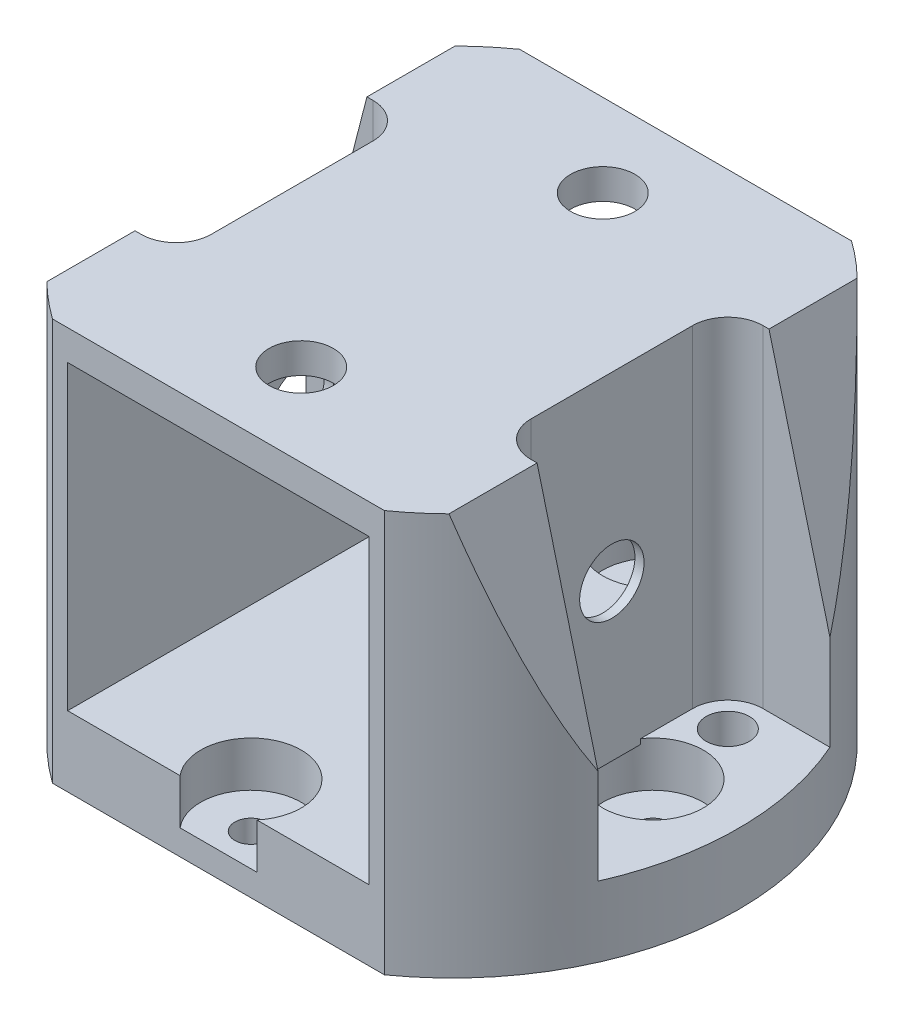
from build123d import *

# Parameters (mm, degrees)
SKETCH1_W                       = 30
SKETCH1_H                       = 30
BOSS_EXTRUDE1_DEPTH             = 28.5
CUT_EXTRUDE1_DEPTH              = 53.091266063
CUT_EXTRUDE1_DEPTH_BACK         = 53.091266063
SKETCH3_R                       = 2.15
SKETCH3_R_2                     = 1.6
CUT_EXTRUDE2_DEPTH              = 53.091266063
CUT_EXTRUDE3_DEPTH              = 53.091266063
CUT_EXTRUDE3_DEPTH_BACK         = 53.091266063
SKETCH5_OUTSIDE_W               = 76.998
SKETCH5_OUTSIDE_H               = 76.998
SKETCH5_OUTSIDE_R               = 28.5
CUT_EXTRUDE4_DEPTH              = 53.091266063
CUT_EXTRUDE4_DEPTH_BACK         = 53.091266063
SKETCH7_R                       = 5
CUT_EXTRUDE5_DEPTH              = 4.5
SKETCH3_3_R                     = 1.6
CUT_EXTRUDE6_DEPTH              = 50.406816501
SKETCH8_R                       = 5
CUT_EXTRUDE7_DEPTH              = 4.5
SKETCH9_W                       = 0.901470183
SKETCH9_H                       = 10
BOSS_EXTRUDE2_DEPTH             = 33.5
CUT_EXTRUDE9_DEPTH              = 50.406816501
CUT_EXTRUDE9_DEPTH_BACK         = 50.406816501
SKETCH10_R                      = 3.2
CUT_EXTRUDE10_REACH             = 56.333
SKETCH11_R                      = 3.2
CUT_EXTRUDE10_DIRECTION_2_DEPTH = 55.33261927


with BuildPart() as part:
    # Sketch1 → Boss-Extrude1 (new, symmetric)
    with BuildSketch(Plane.XY):
        Polygon((-28.5, 0), (-20, 33), (20, 33), (28.5, 0), (28.5, -7), (-28.5, -7), align=None)
        with Locations((0, 15)):
            Rectangle(SKETCH1_W, SKETCH1_H, mode=Mode.SUBTRACT)
    extrude(amount=BOSS_EXTRUDE1_DEPTH, both=True)

    # Sketch3 → Cut-Extrude1 (cut, two sides: drawn at the far end of the back side and taken through both)
    with BuildSketch(Plane(origin=(0, 0, 0), x_dir=(1, 0, 0), z_dir=(0, 1, 0)).offset(-CUT_EXTRUDE1_DEPTH_BACK)):
        with Locations(Location((-19.401470183, 8.03635208, 0), (0, 0, 270))):
            Circle(SKETCH3_R)
        with Locations(Location((-20, 0, 0), (0, 0, 270))):
            Circle(SKETCH3_R_2)
        with Locations(Location((19.401470183, 8.03635208, 0), (0, 0, 270))):
            Circle(SKETCH3_R)
        with Locations(Location((20, 0, 0), (0, 0, 270))):
            Circle(SKETCH3_R_2)
        with Locations(Location((19.401470183, -8.03635208, 0), (0, 0, 270))):
            Circle(SKETCH3_R)
        with Locations(Location((-19.401470183, -8.03635208, 0), (0, 0, 270))):
            Circle(SKETCH3_R)
    extrude(amount=CUT_EXTRUDE1_DEPTH + CUT_EXTRUDE1_DEPTH_BACK, mode=Mode.SUBTRACT)

    # Sketch4 → Cut-Extrude2 (cut, through all)
    with BuildSketch(Plane(origin=(0, 0, 0), x_dir=(1, 0, 0), z_dir=(0, 1, 0))):
        with BuildLine():
            Line((28.5, 11.53635208), (19.401470183, 11.53635208))
            ThreePointArc((19.401470183, 11.53635208), (16.926596449, 10.511225814), (15.901470183, 8.03635208))
            Line((15.901470183, 8.03635208), (15.901470183, 5))
            Line((15.901470183, 5), (15, 5))
            Line((15, 5), (15, -5))
            Line((15, -5), (15.901470183, -5))
            Line((15.901470183, -5), (15.901470183, -8.03635208))
            ThreePointArc((15.901470183, -8.03635208), (16.926596449, -10.511225814), (19.401470183, -11.53635208))
            Line((19.401470183, -11.53635208), (28.5, -11.53635208))
            Line((28.5, -11.53635208), (28.5, 11.53635208))
        make_face()
        with BuildLine():
            Line((-15.901470183, -5), (-15.901470183, -8.03635208))
            ThreePointArc((-15.901470183, -8.03635208), (-16.926596449, -10.511225814), (-19.401470183, -11.53635208))
            Line((-19.401470183, -11.53635208), (-28.5, -11.53635208))
            Line((-28.5, -11.53635208), (-28.5, 11.53635208))
            Line((-28.5, 11.53635208), (-19.401470183, 11.53635208))
            ThreePointArc((-19.401470183, 11.53635208), (-16.926596449, 10.511225814), (-15.901470183, 8.03635208))
            Line((-15.901470183, 8.03635208), (-15.901470183, 5))
            Line((-15.901470183, 5), (-15, 5))
            Line((-15, 5), (-15, -5))
            Line((-15, -5), (-15.901470183, -5))
        make_face()
    extrude(amount=CUT_EXTRUDE2_DEPTH, mode=Mode.SUBTRACT)

    # Sketch5 outside → Cut-Extrude3 (cut, two sides: drawn at the far end of the back side and taken through both)
    with BuildSketch(Plane(origin=(0, 0, 0), x_dir=(1, 0, 0), z_dir=(0, 1, 0)).offset(-CUT_EXTRUDE3_DEPTH_BACK)):
        Rectangle(SKETCH5_OUTSIDE_W, SKETCH5_OUTSIDE_H)
        with Locations(Location((0, 0, 0), (0, 0, 270))):
            Circle(SKETCH5_OUTSIDE_R, mode=Mode.SUBTRACT)
    extrude(amount=CUT_EXTRUDE3_DEPTH + CUT_EXTRUDE3_DEPTH_BACK, mode=Mode.SUBTRACT)

    # Sketch6 → Cut-Extrude4 (cut, two sides: drawn at the far end of the back side and taken through both)
    with BuildSketch(Plane(origin=(0, 0, 0), x_dir=(1, 0, 0), z_dir=(0, 1, 0)).offset(-CUT_EXTRUDE4_DEPTH_BACK)):
        with BuildLine():
            Line((-16.506558795, -23.233241632), (16.506558795, -23.233241632))
            ThreePointArc((16.506558795, -23.233241632), (0, -28.5), (-16.506558795, -23.233241632))
        make_face()
        with BuildLine():
            Line((-16.506558795, 23.233241632), (16.506558795, 23.233241632))
            ThreePointArc((16.506558795, 23.233241632), (0, 28.5), (-16.506558795, 23.233241632))
        make_face()
    extrude(amount=CUT_EXTRUDE4_DEPTH + CUT_EXTRUDE4_DEPTH_BACK, mode=Mode.SUBTRACT)

    # Sketch7 → Cut-Extrude5 (cut)
    with BuildSketch(Plane.XZ.offset(7)):
        with Locations((-14.142135624, 14.142135624)):
            Circle(SKETCH7_R)
        with Locations(Location((14.142135624, -14.142135624, 0), (0, 0, 180))):
            Circle(SKETCH7_R)
        with Locations((-14.142135624, -14.142135624)):
            Circle(SKETCH7_R)
        with Locations((14.142135624, 14.142135624)):
            Circle(SKETCH7_R)
    extrude(amount=-CUT_EXTRUDE5_DEPTH, mode=Mode.SUBTRACT)

    # Sketch3<3> → Cut-Extrude6 (cut, through all)
    with BuildSketch(Plane(origin=(0, 0, 0), x_dir=(1, 0, 0), z_dir=(0, 1, 0))):
        with Locations(Location((0, 20, 0), (0, 0, 270))):
            Circle(SKETCH3_3_R)
        with Locations(Location((0, -20, 0), (0, 0, 270))):
            Circle(SKETCH3_3_R)
    extrude(amount=-CUT_EXTRUDE6_DEPTH, mode=Mode.SUBTRACT)

    # Sketch8 → Cut-Extrude7 (cut)
    with BuildSketch(Plane(origin=(0, 0, 0), x_dir=(1, 0, 0), z_dir=(0, 1, 0))):
        with Locations((0, -20)):
            Circle(SKETCH8_R)
        with Locations((0, 20)):
            Circle(SKETCH8_R)
        with Locations(Location((-20, 0, 0), (0, 0, 270))):
            Circle(SKETCH8_R)
        with Locations(Location((20, 0, 0), (0, 0, 270))):
            Circle(SKETCH8_R)
    extrude(amount=-CUT_EXTRUDE7_DEPTH, mode=Mode.SUBTRACT)

    # Sketch9 → Boss-Extrude2 (add)
    with BuildSketch(Plane(origin=(0, 33, 0), x_dir=(1, 0, 0), z_dir=(0, 1, 0))):
        with Locations((-15.450735092, 0)):
            Rectangle(SKETCH9_W, SKETCH9_H)
        with Locations((15.450735092, 0)):
            Rectangle(SKETCH9_W, SKETCH9_H)
    extrude(amount=-BOSS_EXTRUDE2_DEPTH)

    # Sketch10 → Cut-Extrude9 (cut, two sides: drawn at the far end of the back side and taken through both)
    with BuildSketch(Plane(origin=(0, 0, 0), x_dir=(0, 0, -1), z_dir=(1, 0, 0)).offset(-CUT_EXTRUDE9_DEPTH_BACK)):
        with Locations((0, 15)):
            Circle(SKETCH10_R)
    extrude(amount=CUT_EXTRUDE9_DEPTH + CUT_EXTRUDE9_DEPTH_BACK, mode=Mode.SUBTRACT)

    # Sketch11 → Cut-Extrude10 (cut, up to next)
    with BuildSketch(Plane(origin=(0, 33, 0), x_dir=(1, 0, 0), z_dir=(0, 1, 0)), mode=Mode.PRIVATE) as cut_extrude10_sk1:
        with Locations(Location((0, 15, 0), (0, 0, 90))):
            Circle(SKETCH11_R)
    cut_extrude10_tool1 = extrude(cut_extrude10_sk1.sketch, amount=-CUT_EXTRUDE10_REACH, mode=Mode.PRIVATE) & part.part
    # Sketch11 → Cut-Extrude10 (cut, up to next)
    with BuildSketch(Plane(origin=(0, 33, 0), x_dir=(1, 0, 0), z_dir=(0, 1, 0)), mode=Mode.PRIVATE) as cut_extrude10_sk2:
        with Locations(Location((0, -15, 0), (0, 0, 90))):
            Circle(SKETCH11_R)
    cut_extrude10_tool2 = extrude(cut_extrude10_sk2.sketch, amount=-CUT_EXTRUDE10_REACH, mode=Mode.PRIVATE) & part.part
    add(cut_extrude10_tool1.solids().sort_by_distance((0, 33, -15))[0], mode=Mode.SUBTRACT)
    add(cut_extrude10_tool2.solids().sort_by_distance((0, 33, 15))[0], mode=Mode.SUBTRACT)

    # Sketch11 → Cut-Extrude10 direction 2 (cut)
    with BuildSketch(Plane(origin=(0, 33, 0), x_dir=(1, 0, 0), z_dir=(0, 1, 0))):
        with Locations(Location((0, 15, 0), (0, 0, 90))):
            Circle(SKETCH11_R)
        with Locations(Location((0, -15, 0), (0, 0, 90))):
            Circle(SKETCH11_R)
    extrude(amount=CUT_EXTRUDE10_DIRECTION_2_DEPTH, mode=Mode.SUBTRACT)


solid = part.part
